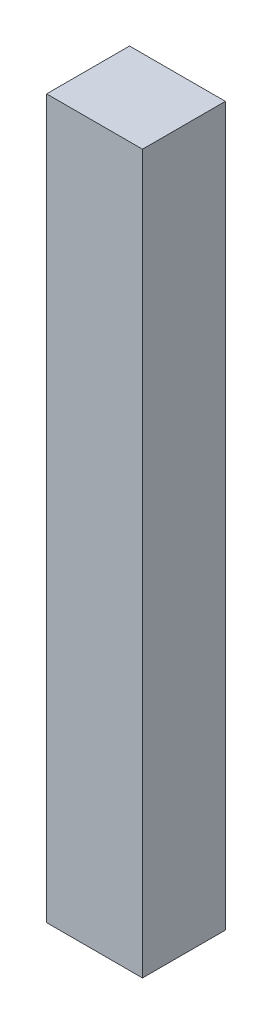
from build123d import *

# Parameters (mm, degrees)
SKETCH1_W           = 9.691439947
SKETCH1_H           = 72.578463039
BOSS_EXTRUDE1_DEPTH = 8.382


with BuildPart() as part:
    # Sketch1 → Boss-Extrude1 (new body)
    with BuildSketch(Plane.XY):
        with Locations((-12.008958195, -7.322248242)):
            Rectangle(SKETCH1_W, SKETCH1_H)
    extrude(amount=BOSS_EXTRUDE1_DEPTH)


solid = part.part
